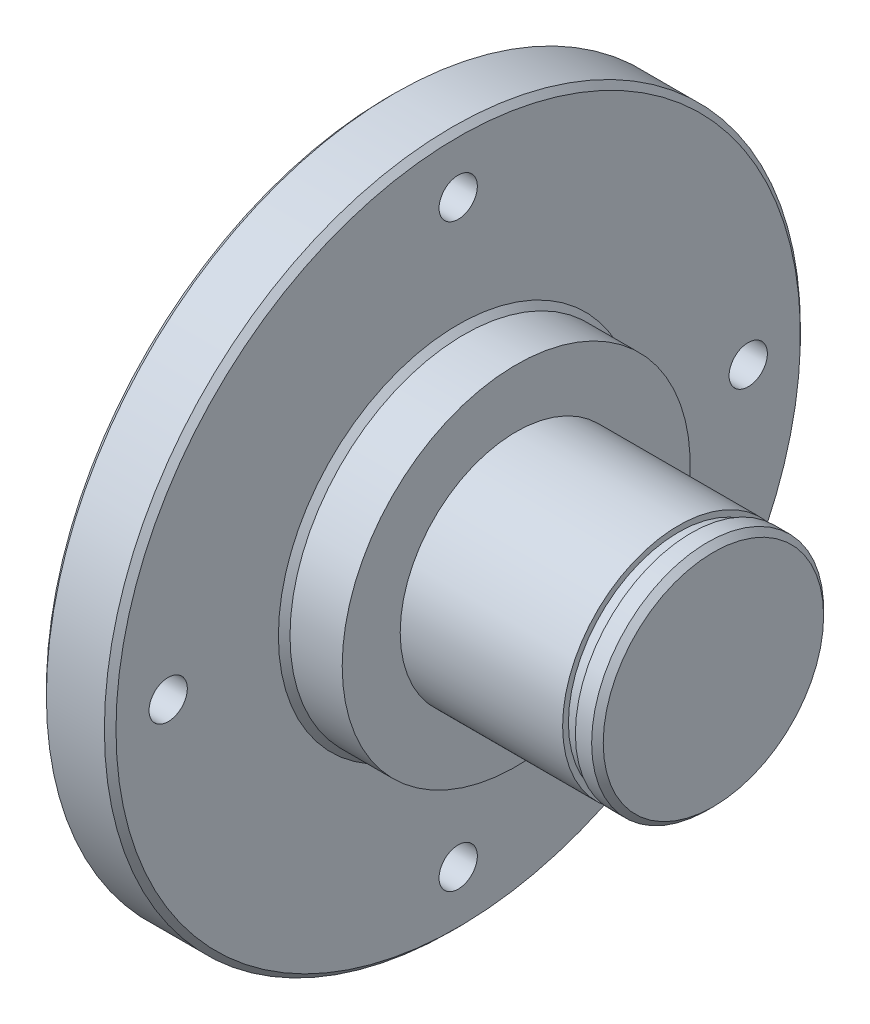
from build123d import *

# Parameters (mm, degrees)
HOLE_WIZARD_M4_1_D = 3.3
CHAMFER_1_SIZE     = 0.5
SKETCH_4_W         = 1.1
SKETCH_4_H         = 0.904012781


with BuildPart() as part:
    # 草图1 → 旋转1 (revolve)
    with BuildSketch(Plane.XY, mode=Mode.PRIVATE) as revolve_1_sk:
        Polygon((0, 0), (0, 30), (6, 30), (6, 15), (11, 15), (11, 10), (28, 10), (28, 0), align=None)
    revolve(revolve_1_sk.sketch.rotate(Axis((-37.713688213, 0, 0), (1, 0, 0)), 90), axis=Axis((-37.713688213, 0, 0), (1, 0, 0)))

    # M4 螺纹孔1 (through all)
    with Locations(Plane(origin=(0, 0, -25), x_dir=(0, 0, -1), z_dir=(-1, 0, 0))):
        with Locations((0, 0), (-25, -25), (-50, 0), (-25, 25)):
            Hole(HOLE_WIZARD_M4_1_D / 2)

    # 倒角1
    chamfer_1_edges = [part.edges().sort_by_distance(p)[0] for p in [
        (28, 0, -10),
        (6, 0, -15),
        (6, 0, -30),
        (0, 0, -30),
    ]]
    chamfer(chamfer_1_edges, length=CHAMFER_1_SIZE)

    # 草图4 → 切除-旋转1 (revolve, cut)
    with BuildSketch(Plane.XY, mode=Mode.PRIVATE) as cut_revolve_1_sk:
        with Locations((25.55, 9.95200639)):
            Rectangle(SKETCH_4_W, SKETCH_4_H)
    revolve(cut_revolve_1_sk.sketch.rotate(Axis((-5.373474488, 0, 0), (1, 0, 0)), 90), axis=Axis((-5.373474488, 0, 0), (1, 0, 0)), mode=Mode.SUBTRACT)


solid = part.part
